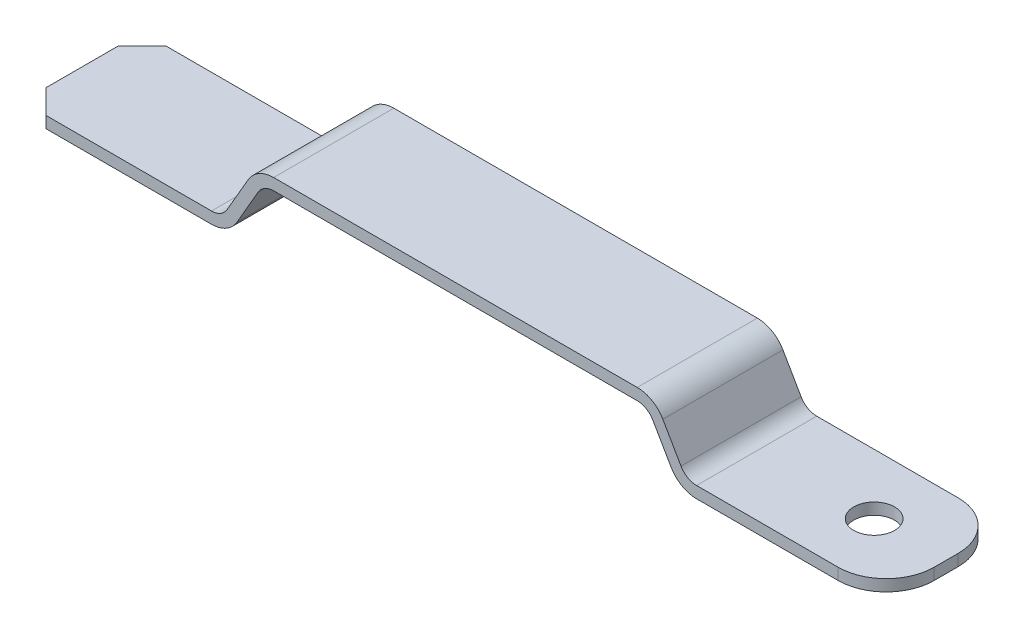
from build123d import *

# Parameters (mm, degrees)
EXTRUDE_THIN1_DEPTH = 6.35
FILLET1_R           = 5.08
CHAMFER1_SIZE       = 2.54
SKETCH2_R           = 2.159
CUT_EXTRUDE1_DEPTH  = 47.635354958


with BuildPart() as part:
    # Sketch1 → Extrude-Thin1 (new, symmetric)
    with BuildSketch(Plane.XY):
        with BuildLine():
            Line((-45.830174209, -6.35), (-25.78993192, -6.35))
            ThreePointArc((-25.78993192, -6.35), (-24.22783192, -5.931436567), (-23.084295354, -4.7879))
            Line((-23.084295354, -4.7879), (-20.869926131, -0.9525))
            ThreePointArc((-20.869926131, -0.9525), (-20.172647737, -0.255221606), (-19.220147737, 0))
            Line((-19.220147737, 0), (19.220147737, 0))
            ThreePointArc((19.220147737, 0), (20.172647737, -0.255221606), (20.869926131, -0.9525))
            Line((20.869926131, -0.9525), (22.791001417, -4.2799))
            ThreePointArc((22.791001417, -4.2799), (23.934537984, -5.423436567), (25.496637984, -5.842))
            Line((25.496637984, -5.842), (45.536880273, -5.842))
            Line((45.536880273, -5.842), (45.536880273, -4.6228))
            Line((45.536880273, -4.6228), (25.496637984, -4.6228))
            ThreePointArc((25.496637984, -4.6228), (24.544137984, -4.367578394), (23.846859589, -3.6703))
            Line((23.846859589, -3.6703), (21.925784304, -0.3429))
            ThreePointArc((21.925784304, -0.3429), (20.782247737, 0.800636567), (19.220147737, 1.2192))
            Line((19.220147737, 1.2192), (-19.220147737, 1.2192))
            ThreePointArc((-19.220147737, 1.2192), (-20.782247737, 0.800636567), (-21.925784304, -0.3429))
            Line((-21.925784304, -0.3429), (-24.140153526, -4.1783))
            ThreePointArc((-24.140153526, -4.1783), (-24.83743192, -4.875578394), (-25.78993192, -5.1308))
            Line((-25.78993192, -5.1308), (-45.830174209, -5.1308))
            Line((-45.830174209, -5.1308), (-45.830174209, -6.35))
        make_face()
    extrude(amount=EXTRUDE_THIN1_DEPTH, both=True)

    # Fillet1
    fillet1_edges = [part.edges().sort_by_distance(p)[0] for p in [
        (45.536880273, -5.2324, -6.35),
        (45.536880273, -5.2324, 6.35),
    ]]
    fillet(fillet1_edges, radius=FILLET1_R)

    # Chamfer1
    chamfer1_edges = [part.edges().sort_by_distance(p)[0] for p in [
        (-45.830174209, -5.7404, -6.35),
        (-45.830174209, -5.7404, 6.35),
    ]]
    chamfer(chamfer1_edges, length=CHAMFER1_SIZE)

    # Sketch2 → Cut-Extrude1 (cut, through all)
    with BuildSketch(Plane(origin=(0, -4.6228, 0), x_dir=(1, 0, 0), z_dir=(0, 1, 0))):
        with Locations(Location((37.916880273, 0, 0), (0, 0, 270))):
            Circle(SKETCH2_R)
    extrude(amount=-CUT_EXTRUDE1_DEPTH, mode=Mode.SUBTRACT)


solid = part.part
